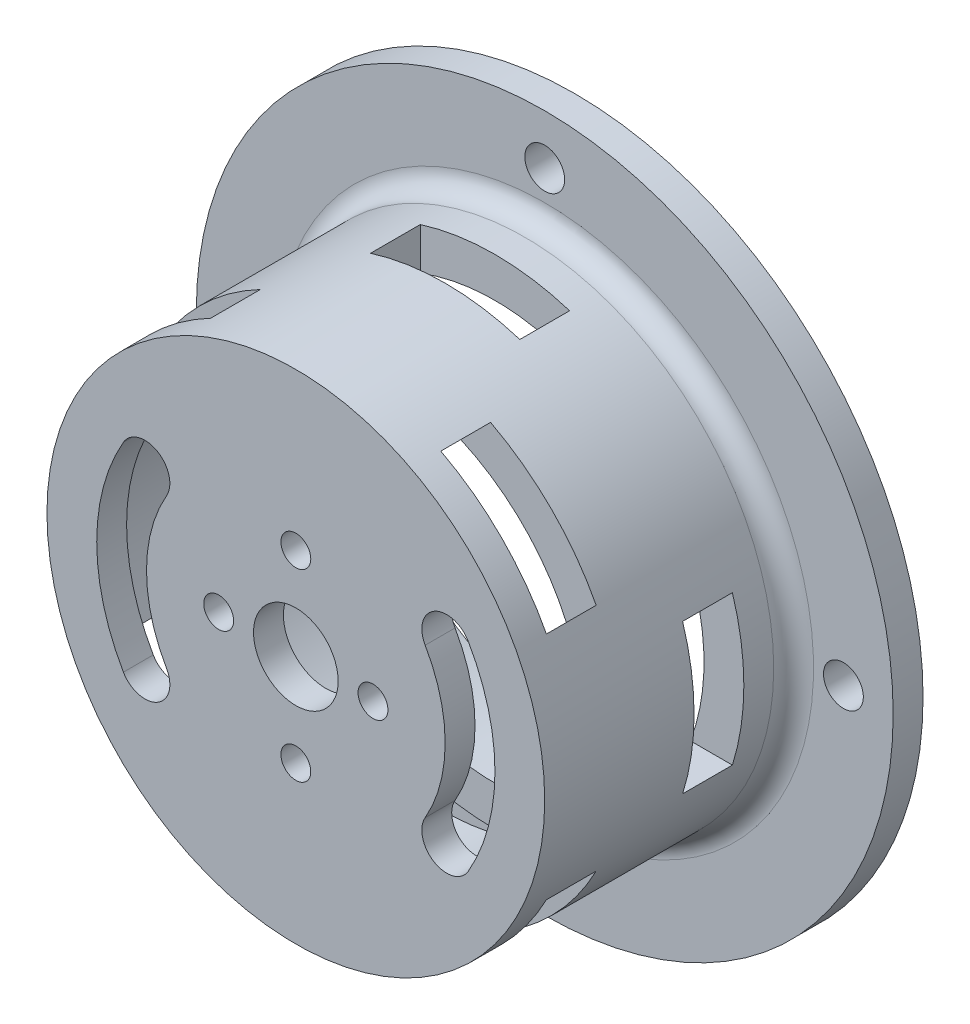
from build123d import *

# Parameters (mm, degrees)
SKETCH_1_R               = 25
SKETCH_1_R_2             = 21
EXTRUDE_1_DEPTH          = 25
SKETCH_2_R               = 25
EXTRUDE_2_DEPTH          = 3
SKETCH_3_R               = 4.25
SKETCH_3_R_2             = 1.5
CUT_EXTRUDE_1_DEPTH      = 3
CUT_EXTRUDE_2_DEPTH      = 3
SKETCH_6_W               = 15
SKETCH_6_H               = 5
CUT_EXTRUDE_3_DEPTH      = 63
SKETCH_8_W               = 5
SKETCH_8_H               = 15
CUT_EXTRUDE_4_DEPTH      = 63
SKETCH_9_W               = 5
SKETCH_9_H               = 15
CUT_EXTRUDE_5_DEPTH      = 63
PATTERN_CIRCULAR_2_COUNT = 4
SKETCH_10_R              = 35
SKETCH_10_R_2            = 21
EXTRUDE_3_DEPTH          = 3
SKETCH_11_R              = 2
CUT_EXTRUDE_6_DEPTH      = 3
FILLET_1_R               = 2


with BuildPart() as part:
    # 草图1 → 凸台-拉伸1 (new body)
    with BuildSketch(Plane.XY):
        Circle(SKETCH_1_R)
        Circle(SKETCH_1_R_2, mode=Mode.SUBTRACT)
    extrude(amount=EXTRUDE_1_DEPTH)

    # 草图2 → 凸台-拉伸2 (add)
    with BuildSketch(Plane.XY.offset(25)):
        Circle(SKETCH_2_R)
    extrude(amount=EXTRUDE_2_DEPTH)

    # 草图3 → 切除-拉伸1 (cut)
    with BuildSketch(Plane.XY.offset(28)):
        Circle(SKETCH_3_R)
        with Locations((0, 9.25)):
            Circle(SKETCH_3_R_2)
        with Locations((7.75, 0)):
            Circle(SKETCH_3_R_2)
        with Locations(Location((0, -9.25, 0), (0, 0, 180))):
            Circle(SKETCH_3_R_2)
        with Locations(Location((-7.75, 0, 0), (0, 0, 180))):
            Circle(SKETCH_3_R_2)
    extrude(amount=-CUT_EXTRUDE_1_DEPTH, mode=Mode.SUBTRACT)

    # 草图4 → 切除-拉伸2 (cut)
    with BuildSketch(Plane.XY.offset(28)):
        with BuildLine():
            ThreePointArc((-17.320508076, 10), (-20, 0), (-17.320508076, -10))
            ThreePointArc((-17.320508076, -10), (-13.905444566, -10.915063509), (-12.990381057, -7.5))
            ThreePointArc((-12.990381057, -7.5), (-15, 0), (-12.990381057, 7.5))
            ThreePointArc((-12.990381057, 7.5), (-13.905444566, 10.915063509), (-17.320508076, 10))
        make_face()
        with BuildLine():
            ThreePointArc((17.320508076, 10), (20, 0), (17.320508076, -10))
            ThreePointArc((17.320508076, -10), (13.905444566, -10.915063509), (12.990381057, -7.5))
            ThreePointArc((12.990381057, -7.5), (15, 0), (12.990381057, 7.5))
            ThreePointArc((12.990381057, 7.5), (13.905444566, 10.915063509), (17.320508076, 10))
        make_face()
    extrude(amount=-CUT_EXTRUDE_2_DEPTH, mode=Mode.SUBTRACT)

    # 草图6 → 切除-拉伸3 (cut)
    with BuildSketch(Plane(origin=(17.67766953, 17.67766953, 28), x_dir=(0.7071067811865488, -0.7071067811865464, 0), z_dir=(0.7071067811865464, 0.7071067811865488, 0))):
        with Locations((0, 5.5)):
            Rectangle(SKETCH_6_W, SKETCH_6_H)
    extrude(amount=-CUT_EXTRUDE_3_DEPTH, mode=Mode.SUBTRACT)

    # 草图8 → 切除-拉伸4 (cut)
    with BuildSketch(Plane(origin=(-17.67766953, 17.67766953, 28), x_dir=(0, 0, 1), z_dir=(-0.7071067811865517, 0.7071067811865435, 0))):
        with Locations((-5.5, 0)):
            Rectangle(SKETCH_8_W, SKETCH_8_H)
    extrude(amount=-CUT_EXTRUDE_4_DEPTH, mode=Mode.SUBTRACT)

    # 草图9 → 切除-拉伸5 (cut)
    with BuildSketch(Plane(origin=(0, 0, 0), x_dir=(0, 0, -1), z_dir=(1, 0, 0))):
        with Locations((-10.5, 0)):
            Rectangle(SKETCH_9_W, SKETCH_9_H)
    cut_extrude_5 = extrude(amount=-CUT_EXTRUDE_5_DEPTH, mode=Mode.SUBTRACT)

    # 阵列(圆周)2: 切除-拉伸5 ×4 about axis
    pattern_circular_2_axis = Axis((0, 0, 0), (0, 0, 1))
    for i in range(1, PATTERN_CIRCULAR_2_COUNT):
        add(cut_extrude_5.rotate(pattern_circular_2_axis, i * 360 / PATTERN_CIRCULAR_2_COUNT), mode=Mode.SUBTRACT)

    # 草图10 → 凸台-拉伸3 (add)
    with BuildSketch(Plane(origin=(0, 0, 0), x_dir=(-1, 0, 0), z_dir=(0, 0, -1))):
        Circle(SKETCH_10_R)
        with Locations(Location((0, 0, 0), (0, 0, 24.075167572))):
            Circle(SKETCH_10_R_2, mode=Mode.SUBTRACT)
    extrude(amount=-EXTRUDE_3_DEPTH)

    # 草图11 → 切除-拉伸6 (cut)
    with BuildSketch(Plane(origin=(0, 0, 0), x_dir=(-1, 0, 0), z_dir=(0, 0, -1))):
        with Locations((0, 30)):
            Circle(SKETCH_11_R)
        with Locations((30, 0)):
            Circle(SKETCH_11_R)
        with Locations((0, -30)):
            Circle(SKETCH_11_R)
        with Locations((-30, 0)):
            Circle(SKETCH_11_R)
    extrude(amount=-CUT_EXTRUDE_6_DEPTH, mode=Mode.SUBTRACT)

    # 圆角1
    fillet_1_edges = [part.edges().sort_by_distance(p)[0] for p in [
        (-25, 0, 3),
    ]]
    fillet(fillet_1_edges, radius=FILLET_1_R)


solid = part.part
